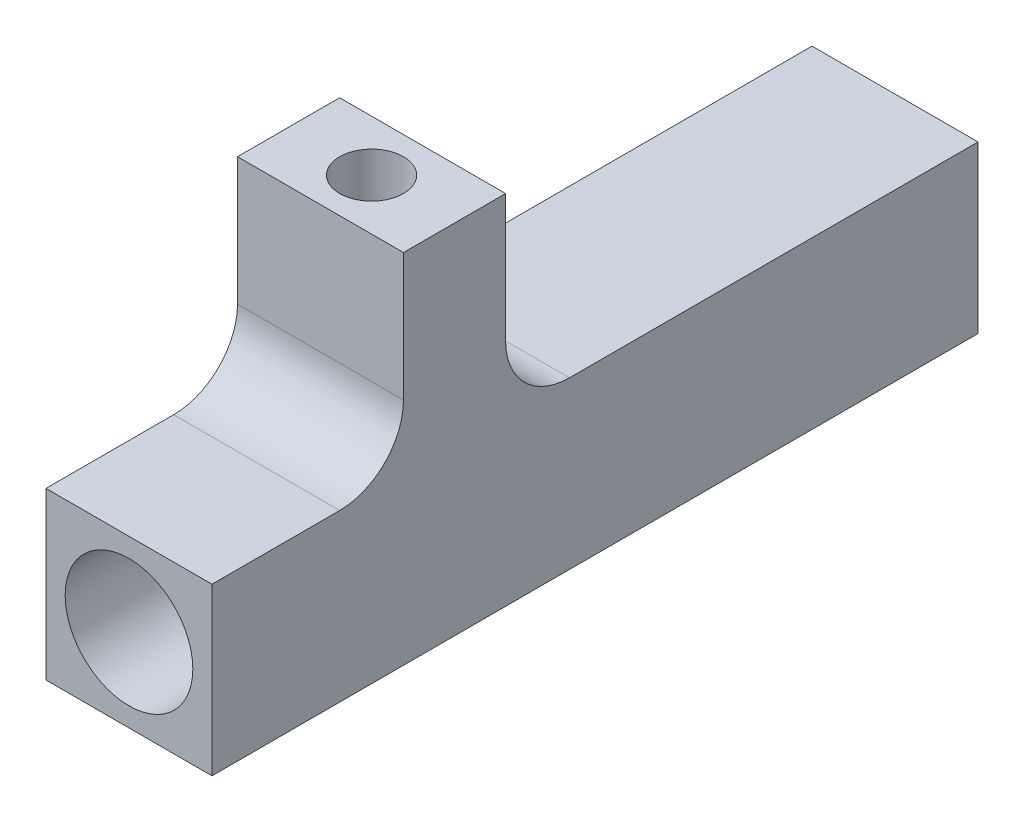
from build123d import *

# Parameters (mm, degrees)
BOSS_EXTRUDE1_DEPTH            = 13
BOSS_EXTRUDE1_DEPTH_BACK       = 13
CUT_EXTRUDE1_REACH             = 111.627
SKETCH1_R                      = 10
CUT_EXTRUDE1_DIRECTION_2_REACH = 111.627
CUT_EXTRUDE2_REACH             = 117.347
CUT_EXTRUDE2_END_RADIUS        = 10
SKETCH3_R                      = 5


with BuildPart() as part:
    # Sketch2 → Boss-Extrude1 (new, two sides: drawn at the far end of the back side and taken through both)
    with BuildSketch(Plane(origin=(0, 0, 0), x_dir=(0, 0, -1), z_dir=(1, 0, 0)).offset(-BOSS_EXTRUDE1_DEPTH_BACK)):
        with BuildLine():
            Line((36, 13), (100, 13))
            Line((100, 13), (100, -13))
            Line((100, -13), (0, -13))
            Line((0, -13), (-20, -13))
            Line((-20, -13), (-20, 13))
            Line((-20, 13), (0, 13))
            ThreePointArc((0, 13), (7.071067812, 15.928932188), (10, 23))
            Line((10, 23), (10, 43))
            Line((10, 43), (26, 43))
            Line((26, 43), (26, 23))
            ThreePointArc((26, 23), (28.928932188, 15.928932188), (36, 13))
        make_face()
    extrude(amount=BOSS_EXTRUDE1_DEPTH + BOSS_EXTRUDE1_DEPTH_BACK)

    # Cut-Extrude1: up to this face of the body (flat: up to its plane)
    cut_extrude1_end = Plane(part.part.faces().sort_by_distance((0, 0, -100))[0])
    # Sketch1 → Cut-Extrude1 (cut, up to the picked face)
    with BuildSketch(Plane.XY, mode=Mode.PRIVATE) as cut_extrude1_sk1:
        Circle(SKETCH1_R)
    cut_extrude1_tool1 = split(extrude(cut_extrude1_sk1.sketch, amount=-CUT_EXTRUDE1_REACH, mode=Mode.PRIVATE), bisect_by=cut_extrude1_end, keep=Keep.BOTH, mode=Mode.PRIVATE)
    add(cut_extrude1_tool1.solids().sort_by(Axis((0, 0, 0), (0, 0, -1)))[0], mode=Mode.SUBTRACT)

    # Cut-Extrude1 direction 2: up to this face of the body (flat: up to its plane)
    cut_extrude1_direction_2_end = Plane(part.part.faces().sort_by_distance((0, 0, 20))[0])
    # Sketch1 → Cut-Extrude1 direction 2 (cut, up to the picked face)
    with BuildSketch(Plane.XY, mode=Mode.PRIVATE) as cut_extrude1_direction_2_sk1:
        Circle(SKETCH1_R)
    cut_extrude1_direction_2_tool1 = split(extrude(cut_extrude1_direction_2_sk1.sketch, amount=CUT_EXTRUDE1_DIRECTION_2_REACH, mode=Mode.PRIVATE), bisect_by=cut_extrude1_direction_2_end, keep=Keep.BOTH, mode=Mode.PRIVATE)
    add(cut_extrude1_direction_2_tool1.solids().sort_by(Axis((0, 0, 0), (0, 0, 1)))[0], mode=Mode.SUBTRACT)

    # Cut-Extrude2: up to this cylinder (the profile starts outside it)
    cut_extrude2_end = Plane(origin=(0, 0, -18), z_dir=(0, 0, 1)) * Cylinder(CUT_EXTRUDE2_END_RADIUS, 255.694, mode=Mode.PRIVATE)
    # Sketch3 → Cut-Extrude2 (cut, up to the surface)
    with BuildSketch(Plane(origin=(0, 43, 0), x_dir=(1, 0, 0), z_dir=(0, 1, 0)), mode=Mode.PRIVATE) as cut_extrude2_sk1:
        with Locations(Location((0, 18, 0), (0, 0, 270))):
            Circle(SKETCH3_R)
    cut_extrude2_tool1 = extrude(cut_extrude2_sk1.sketch, amount=-CUT_EXTRUDE2_REACH, mode=Mode.PRIVATE) - cut_extrude2_end
    add(cut_extrude2_tool1.solids().sort_by_distance((0, 43, -18))[0], mode=Mode.SUBTRACT)


solid = part.part
